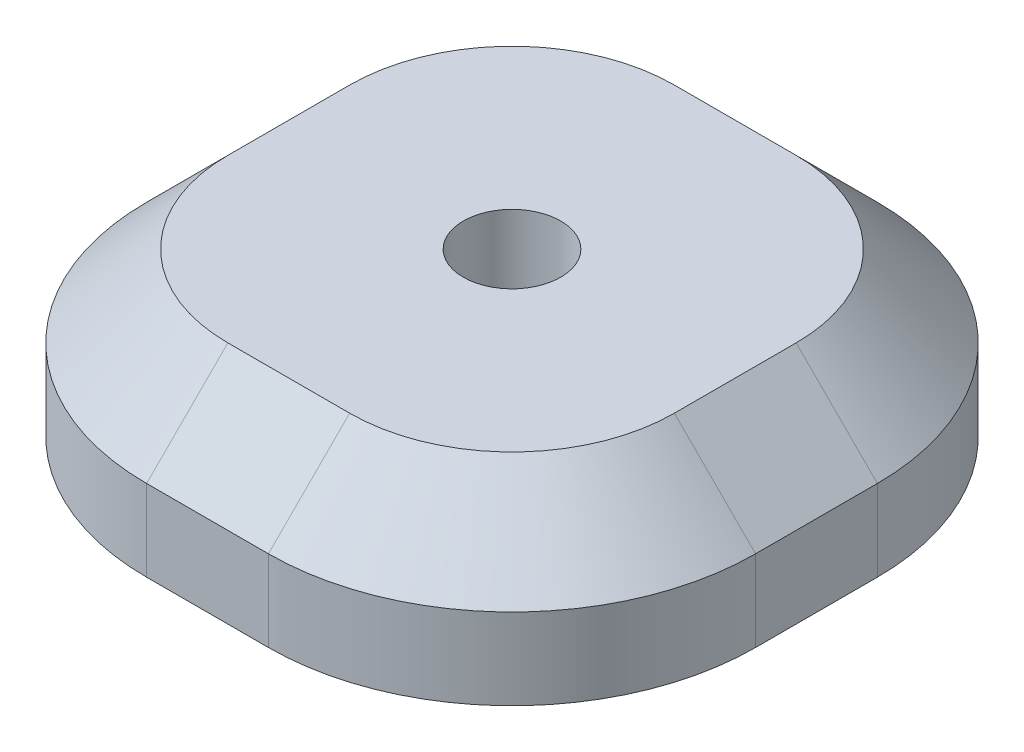
from build123d import *

# Parameters (mm, degrees)
BOSS_EXTRUDE1_DEPTH = 10
CHAMFER1_SIZE       = 10
SKETCH3_R           = 6
CUT_EXTRUDE2_DEPTH  = 10
SKETCH5_R           = 6
CUT_EXTRUDE3_DEPTH  = 10


with BuildPart() as part:
    # Sketch1 → Boss-Extrude1 (new, symmetric)
    with BuildSketch(Plane(origin=(0, 0, 0), x_dir=(1, 0, 0), z_dir=(0, 1, 0))):
        with BuildLine():
            Line((-7.5, 37.5), (7.5, 37.5))
            ThreePointArc((7.5, 37.5), (28.713203436, 28.713203436), (37.5, 7.5))
            Line((37.5, 7.5), (37.5, -7.5))
            ThreePointArc((37.5, -7.5), (28.713203436, -28.713203436), (7.5, -37.5))
            Line((7.5, -37.5), (-7.5, -37.5))
            ThreePointArc((-7.5, -37.5), (-28.713203436, -28.713203436), (-37.5, -7.5))
            Line((-37.5, -7.5), (-37.5, 7.5))
            ThreePointArc((-37.5, 7.5), (-28.713203436, 28.713203436), (-7.5, 37.5))
        make_face()
    extrude(amount=BOSS_EXTRUDE1_DEPTH, both=True)

    # Chamfer1
    chamfer1_edges = [part.edges().sort_by_distance(p)[0] for p in [
        (28.713203436, 10, 28.713203436),
        (37.5, 10, 0),
        (28.713203436, 10, -28.713203436),
        (0, 10, -37.5),
        (-28.713203436, 10, -28.713203436),
        (-37.5, 10, 0),
        (-28.713203436, 10, 28.713203436),
        (0, 10, 37.5),
    ]]
    chamfer(chamfer1_edges, length=CHAMFER1_SIZE)

    # Sketch3 → Cut-Extrude2 (cut)
    with BuildSketch(Plane.XZ.offset(10)):
        with Locations(Location((12.5, 12.5, 0), (0, 0, 270))):
            Circle(SKETCH3_R)
        with Locations(Location((-12.5, 12.5, 0), (0, 0, 270))):
            Circle(SKETCH3_R)
        with Locations(Location((12.5, -12.5, 0), (0, 0, 270))):
            Circle(SKETCH3_R)
        with Locations(Location((-12.5, -12.5, 0), (0, 0, 270))):
            Circle(SKETCH3_R)
    extrude(amount=-CUT_EXTRUDE2_DEPTH, mode=Mode.SUBTRACT)

    # Sketch5 → Cut-Extrude3 (cut)
    with BuildSketch(Plane(origin=(0, 10, 0), x_dir=(1, 0, 0), z_dir=(0, 1, 0))):
        with Locations(Location((0, 0, 0), (0, 0, 270))):
            Circle(SKETCH5_R)
    extrude(amount=-CUT_EXTRUDE3_DEPTH, mode=Mode.SUBTRACT)


solid = part.part
